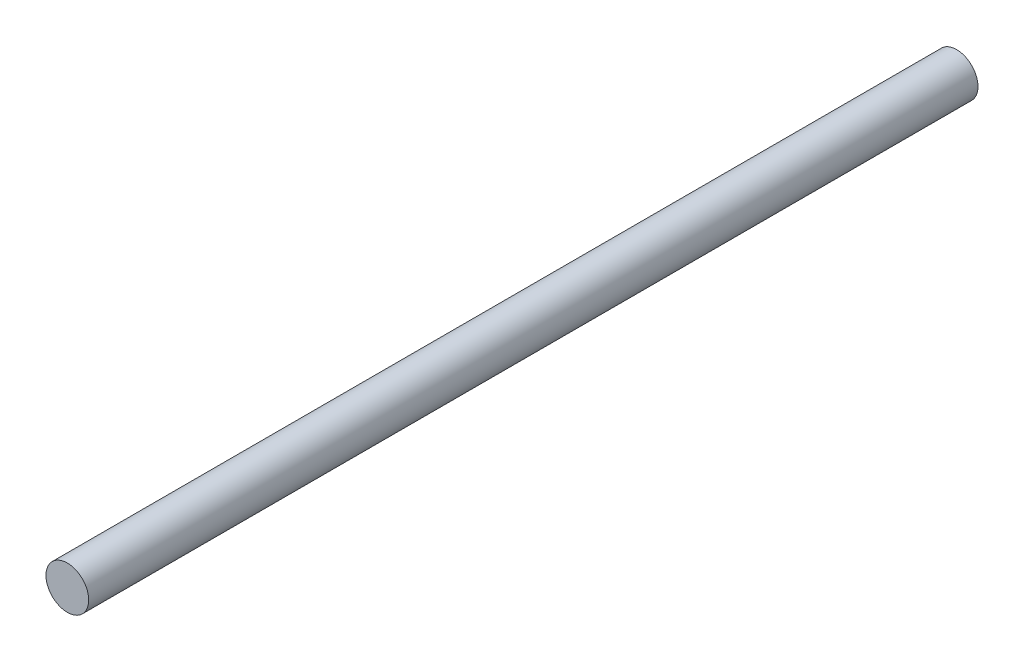
from build123d import *

# Parameters (mm, degrees)
SKETCH1_R           = 1.25
BOSS_EXTRUDE1_DEPTH = 52


with BuildPart() as part:
    # Sketch1 → Boss-Extrude1 (new body)
    with BuildSketch(Plane.XY):
        Circle(SKETCH1_R)
    extrude(amount=BOSS_EXTRUDE1_DEPTH)


solid = part.part
